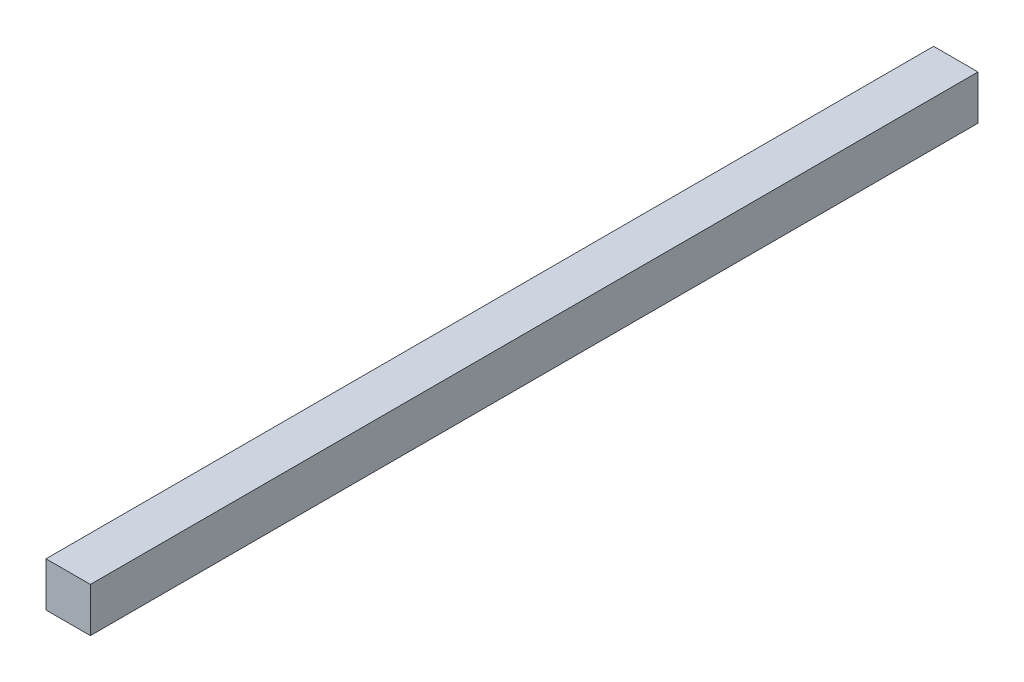
from build123d import *

# Parameters (mm, degrees)
SKETCH_1_W            = 10
SKETCH_1_H            = 10
EXTRUDE_1_DEPTH       = 300
SKETCH_2_W            = 10
SKETCH_2_H            = 10
CUT_EXTRUDE_1_DEPTH   = 100
SKETCH_3_W            = 26
SKETCH_3_H            = 26
SKETCH_3_W_2          = 6
SKETCH_3_H_2          = 6
CUT_EXTRUDE_1_2_DEPTH = 201.124960962
SKETCH_4_W            = 6.990090154
SKETCH_4_H            = 6.654359222
CUT_EXTRUDE_2_DEPTH   = 80


with BuildPart() as part:
    # 草图1 → 凸台-拉伸1 (new body)
    with BuildSketch(Plane.XY):
        Rectangle(SKETCH_1_W, SKETCH_1_H)
    extrude(amount=EXTRUDE_1_DEPTH)

    # 草图2 → Cut-Extrude 1 (cut)
    with BuildSketch(Plane(origin=(0, 0, 0), x_dir=(-1, 0, 0), z_dir=(0, 0, -1))):
        Rectangle(SKETCH_2_W, SKETCH_2_H)
    extrude(amount=-CUT_EXTRUDE_1_DEPTH, mode=Mode.SUBTRACT)

    # 草图3 → Cut-Extrude 1 2 (cut, through all)
    with BuildSketch(Plane(origin=(0, 0, 100), x_dir=(-1, 0, 0), z_dir=(0, 0, -1))):
        Rectangle(SKETCH_3_W, SKETCH_3_H)
        Rectangle(SKETCH_3_W_2, SKETCH_3_H_2, mode=Mode.SUBTRACT)
    extrude(amount=-CUT_EXTRUDE_1_2_DEPTH, mode=Mode.SUBTRACT)

    # 草图4 → 切除-拉伸2 (cut)
    with BuildSketch(Plane(origin=(0, 0, 100), x_dir=(-1, 0, 0), z_dir=(0, 0, -1))):
        Rectangle(SKETCH_4_W, SKETCH_4_H)
    extrude(amount=-CUT_EXTRUDE_2_DEPTH, mode=Mode.SUBTRACT)


solid = part.part
